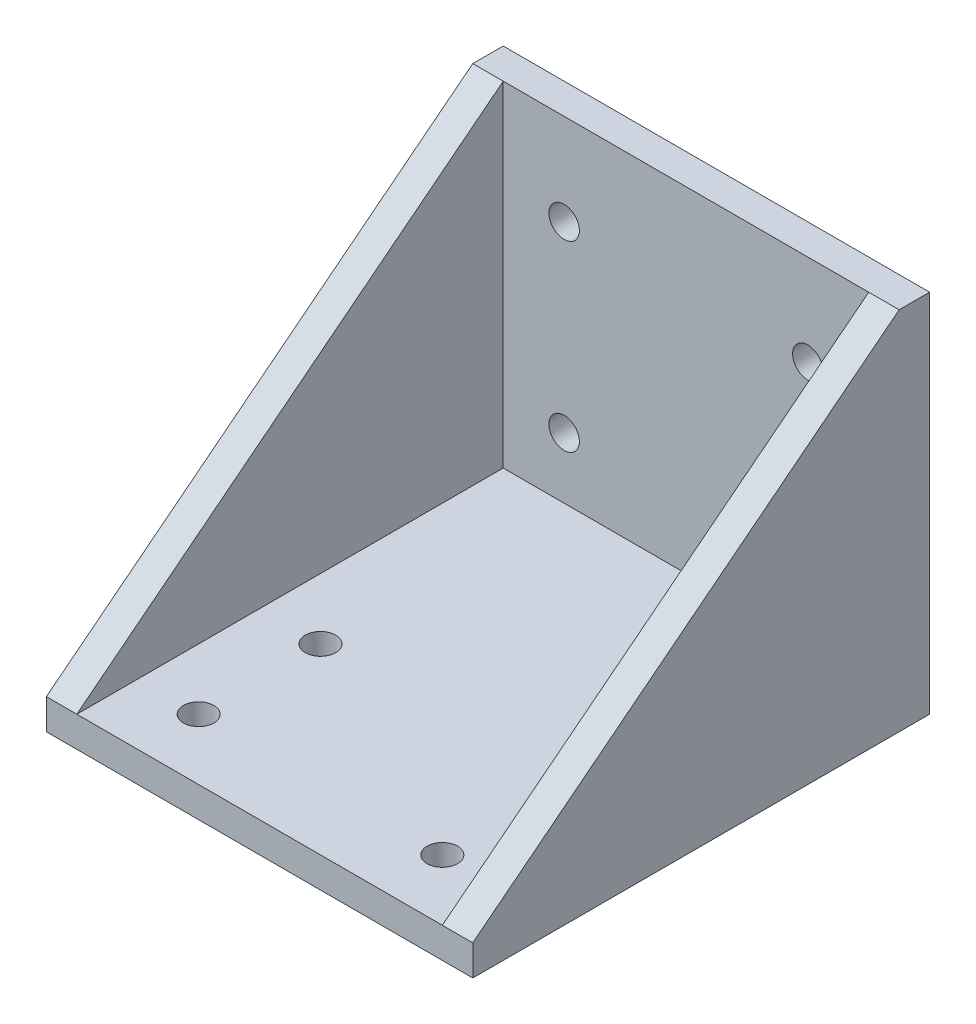
from build123d import *

# Parameters (mm, degrees)
SKETCH_1_W          = 70
SKETCH_1_H          = 60
SKETCH_1_R          = 2.5
EXTRUDE_1_DEPTH     = 5
EXTRUDE_2_DEPTH     = 70
CUT_EXTRUDE_1_DEPTH = 70
SKETCH_4_R          = 2.5
CUT_EXTRUDE_2_DEPTH = 5


with BuildPart() as part:
    # 草图1 → 凸台-拉伸1 (new body)
    with BuildSketch(Plane.XY):
        Rectangle(SKETCH_1_W, SKETCH_1_H)
        with Locations((-20, 15)):
            Circle(SKETCH_1_R, mode=Mode.SUBTRACT)
        with Locations((20, 15)):
            Circle(SKETCH_1_R, mode=Mode.SUBTRACT)
        with Locations((-20, -15)):
            Circle(SKETCH_1_R, mode=Mode.SUBTRACT)
        with Locations((20, -15)):
            Circle(SKETCH_1_R, mode=Mode.SUBTRACT)
    extrude(amount=EXTRUDE_1_DEPTH)

    # 草图2 → 凸台-拉伸2 (add)
    with BuildSketch(Plane.XY.offset(5)):
        Polygon((-30, 30), (-35, 30), (-35, -30), (35, -30), (35, 30), (30, 30), (30, -25), (-30, -25), align=None)
    extrude(amount=EXTRUDE_2_DEPTH)

    # 草图3 → 切除-拉伸1 (cut)
    with BuildSketch(Plane.ZY.offset(35)):
        Polygon((5, 30), (75, -25), (75, 30), align=None)
    extrude(amount=-CUT_EXTRUDE_1_DEPTH, mode=Mode.SUBTRACT)

    # 草图4 → 切除-拉伸2 (cut)
    with BuildSketch(Plane.XZ.offset(30)):
        with Locations(Location((-20, 65, 0), (0, 0, 270))):
            Circle(SKETCH_4_R)
        with Locations(Location((20, 65, 0), (0, 0, 270))):
            Circle(SKETCH_4_R)
        with Locations(Location((-20, 45, 0), (0, 0, 270))):
            Circle(SKETCH_4_R)
        with Locations(Location((20, 45, 0), (0, 0, 270))):
            Circle(SKETCH_4_R)
    extrude(amount=-CUT_EXTRUDE_2_DEPTH, mode=Mode.SUBTRACT)


solid = part.part
